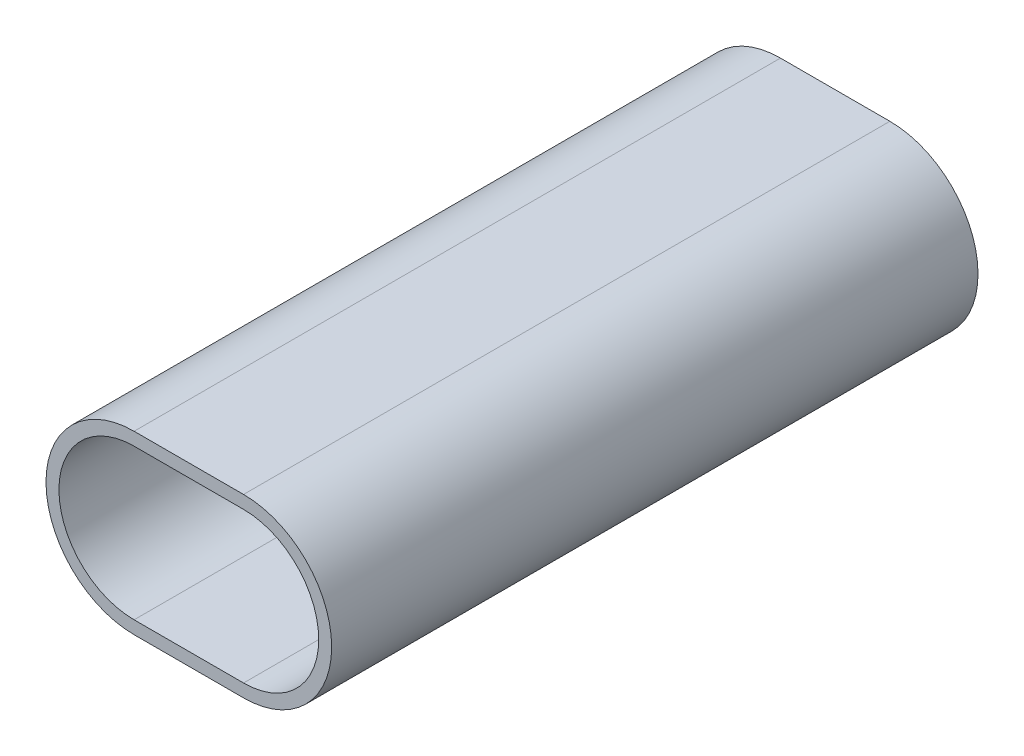
from build123d import *

# Parameters (mm, degrees)
BOSS_EXTRUDE1_DEPTH = 75


with BuildPart() as part:
    # Sketch2 → Boss-Extrude1 (new, symmetric)
    with BuildSketch(Plane.XY):
        with BuildLine():
            Line((-12.7, 20.447), (12.7, 20.447))
            ThreePointArc((12.7, 20.447), (33.147, 0), (12.7, -20.447))
            Line((12.7, -20.447), (-12.7, -20.447))
            ThreePointArc((-12.7, -20.447), (-33.147, 0), (-12.7, 20.447))
        make_face()
        with BuildLine():
            Line((-12.7, 17.447), (12.7, 17.447))
            ThreePointArc((12.7, 17.447), (30.147, 0), (12.7, -17.447))
            Line((12.7, -17.447), (-12.7, -17.447))
            ThreePointArc((-12.7, -17.447), (-30.147, 0), (-12.7, 17.447))
        make_face(mode=Mode.SUBTRACT)
    extrude(amount=BOSS_EXTRUDE1_DEPTH, both=True)


solid = part.part
